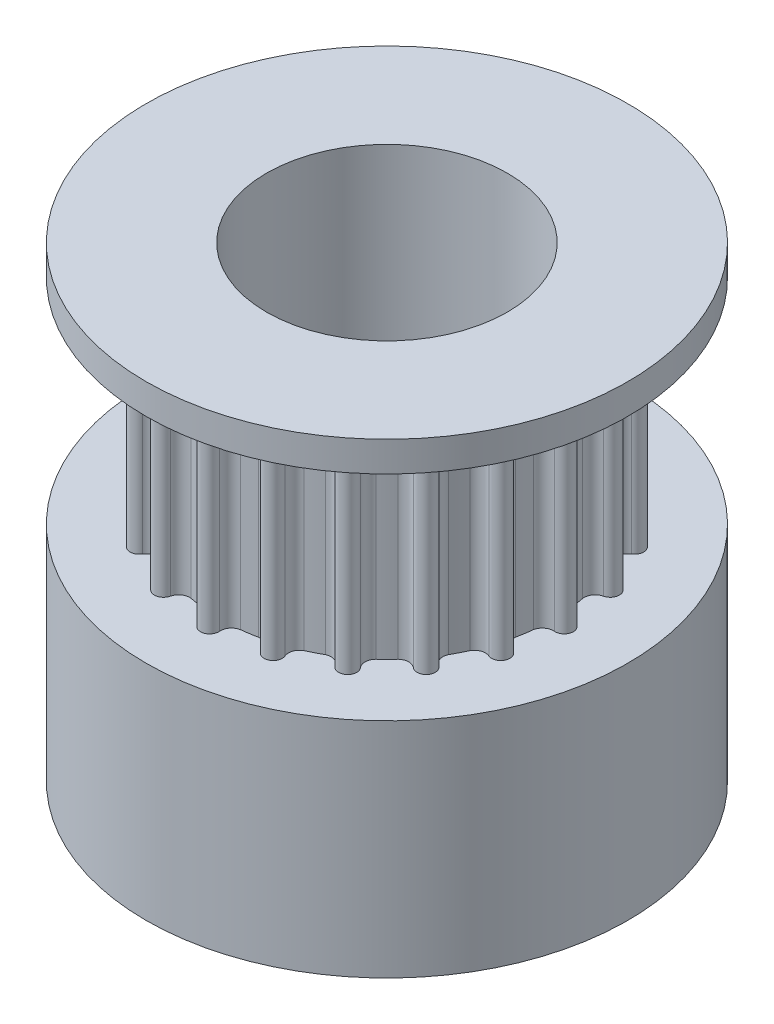
from build123d import *

# Parameters (mm, degrees)
SKETCH2_R               = 8
SKETCH2_R_2             = 4
BOSS_EXTRUDE1_DEPTH     = 15.5
CUT_EXTRUDE1_START      = -8.1
SKETCH3_R               = 8
CUT_EXTRUDE1_DEPTH      = 7.1
CUT_EXTRUDE2_REACH      = 21.19
CUT_EXTRUDE2_END_RADIUS = 8
SKETCH4_R               = 2
CUT_EXTRUDE3_REACH      = 21.19
CUT_EXTRUDE3_END_RADIUS = 8
SKETCH5_R               = 2


with BuildPart() as part:
    # Sketch2 → Boss-Extrude1 (new body)
    with BuildSketch(Plane(origin=(0, 0, 0), x_dir=(1, 0, 0), z_dir=(0, 1, 0))):
        with Locations(Location((0, 0, 0), (0, 0, 270))):
            Circle(SKETCH2_R)
        with Locations(Location((0, 0, 0), (0, 0, 270))):
            Circle(SKETCH2_R_2, mode=Mode.SUBTRACT)
    extrude(amount=BOSS_EXTRUDE1_DEPTH)

    # Sketch3 → Cut-Extrude1 (cut)
    with BuildSketch(Plane(origin=(0, 15.5, 0), x_dir=(1, 0, 0), z_dir=(0, 1, 0)).offset(CUT_EXTRUDE1_START)):
        with Locations(Location((0, 0, 0), (0, 0, 270))):
            Circle(SKETCH3_R)
        with BuildLine():
            ThreePointArc((-0.3, 5.863923227), (0, 6.190300649), (0.3, 5.863923227))
            ThreePointArc((0.3, 5.863923227), (0.374015387, 5.608093492), (0.6, 5.467174773))
            ThreePointArc((0.6, 5.467174773), (0.860389558, 5.432285873), (1.118816006, 5.38500239))
            ThreePointArc((1.118816006, 5.38500239), (1.377286424, 5.44919097), (1.526734976, 5.669627494))
            ThreePointArc((1.526734976, 5.669627494), (1.912908101, 5.88732577), (2.097368886, 5.484217297))
            ThreePointArc((2.097368886, 5.484217297), (2.088705966, 5.218036749), (2.260083826, 5.014181997))
            ThreePointArc((2.260083826, 5.014181997), (2.496947749, 4.900535883), (2.728114507, 4.775708454))
            ThreePointArc((2.728114507, 4.775708454), (2.993769844, 4.75688367), (3.204022495, 4.92034912))
            ThreePointArc((3.204022495, 4.92034912), (3.638567429, 5.008058426), (3.689432692, 4.567677968))
            ThreePointArc((3.689432692, 4.567677968), (3.598939452, 4.317202212), (3.6989349, 4.070366151))
            ThreePointArc((3.6989349, 4.070366151), (3.889087297, 3.889087297), (4.070366151, 3.6989349))
            ThreePointArc((4.070366151, 3.6989349), (4.317202212, 3.598939452), (4.567677968, 3.689432692))
            ThreePointArc((4.567677968, 3.689432692), (5.008058426, 3.638567429), (4.92034912, 3.204022495))
            ThreePointArc((4.92034912, 3.204022495), (4.75688367, 2.993769844), (4.775708454, 2.728114507))
            ThreePointArc((4.775708454, 2.728114507), (4.900535883, 2.496947749), (5.014181997, 2.260083826))
            ThreePointArc((5.014181997, 2.260083826), (5.218036749, 2.088705966), (5.484217297, 2.097368886))
            ThreePointArc((5.484217297, 2.097368886), (5.88732577, 1.912908101), (5.669627494, 1.526734976))
            ThreePointArc((5.669627494, 1.526734976), (5.44919097, 1.377286424), (5.38500239, 1.118816006))
            ThreePointArc((5.38500239, 1.118816006), (5.432285873, 0.860389558), (5.467174773, 0.6))
            ThreePointArc((5.467174773, 0.6), (5.608093492, 0.374015387), (5.863923227, 0.3))
            ThreePointArc((5.863923227, 0.3), (6.190300649, 0), (5.863923227, -0.3))
            ThreePointArc((5.863923227, -0.3), (5.608093492, -0.374015387), (5.467174773, -0.6))
            ThreePointArc((5.467174773, -0.6), (5.432285873, -0.860389558), (5.38500239, -1.118816006))
            ThreePointArc((5.38500239, -1.118816006), (5.44919097, -1.377286424), (5.669627494, -1.526734976))
            ThreePointArc((5.669627494, -1.526734976), (5.88732577, -1.912908101), (5.484217297, -2.097368886))
            ThreePointArc((5.484217297, -2.097368886), (5.218036749, -2.088705966), (5.014181997, -2.260083826))
            ThreePointArc((5.014181997, -2.260083826), (4.900535883, -2.496947749), (4.775708454, -2.728114507))
            ThreePointArc((4.775708454, -2.728114507), (4.75688367, -2.993769844), (4.92034912, -3.204022495))
            ThreePointArc((4.92034912, -3.204022495), (5.008058426, -3.638567429), (4.567677968, -3.689432692))
            ThreePointArc((4.567677968, -3.689432692), (4.317202212, -3.598939452), (4.070366151, -3.6989349))
            ThreePointArc((4.070366151, -3.6989349), (3.889087297, -3.889087297), (3.6989349, -4.070366151))
            ThreePointArc((3.6989349, -4.070366151), (3.598939452, -4.317202212), (3.689432692, -4.567677968))
            ThreePointArc((3.689432692, -4.567677968), (3.638567429, -5.008058426), (3.204022495, -4.92034912))
            ThreePointArc((3.204022495, -4.92034912), (2.993769844, -4.75688367), (2.728114507, -4.775708454))
            ThreePointArc((2.728114507, -4.775708454), (2.496947749, -4.900535883), (2.260083826, -5.014181997))
            ThreePointArc((2.260083826, -5.014181997), (2.088705966, -5.218036749), (2.097368886, -5.484217297))
            ThreePointArc((2.097368886, -5.484217297), (1.912908101, -5.88732577), (1.526734976, -5.669627494))
            ThreePointArc((1.526734976, -5.669627494), (1.377286424, -5.44919097), (1.118816006, -5.38500239))
            ThreePointArc((1.118816006, -5.38500239), (0.860389558, -5.432285873), (0.6, -5.467174773))
            ThreePointArc((0.6, -5.467174773), (0.374015387, -5.608093492), (0.3, -5.863923227))
            ThreePointArc((0.3, -5.863923227), (0, -6.190300649), (-0.3, -5.863923227))
            ThreePointArc((-0.3, -5.863923227), (-0.374015387, -5.608093492), (-0.6, -5.467174773))
            ThreePointArc((-0.6, -5.467174773), (-0.860389558, -5.432285873), (-1.118816006, -5.38500239))
            ThreePointArc((-1.118816006, -5.38500239), (-1.377286424, -5.44919097), (-1.526734976, -5.669627494))
            ThreePointArc((-1.526734976, -5.669627494), (-1.912908101, -5.88732577), (-2.097368886, -5.484217297))
            ThreePointArc((-2.097368886, -5.484217297), (-2.088705966, -5.218036749), (-2.260083826, -5.014181997))
            ThreePointArc((-2.260083826, -5.014181997), (-2.496947749, -4.900535883), (-2.728114507, -4.775708454))
            ThreePointArc((-2.728114507, -4.775708454), (-2.993769844, -4.75688367), (-3.204022495, -4.92034912))
            ThreePointArc((-3.204022495, -4.92034912), (-3.638567429, -5.008058426), (-3.689432692, -4.567677968))
            ThreePointArc((-3.689432692, -4.567677968), (-3.598939452, -4.317202212), (-3.6989349, -4.070366151))
            ThreePointArc((-3.6989349, -4.070366151), (-3.889087297, -3.889087297), (-4.070366151, -3.6989349))
            ThreePointArc((-4.070366151, -3.6989349), (-4.317202212, -3.598939452), (-4.567677968, -3.689432692))
            ThreePointArc((-4.567677968, -3.689432692), (-5.008058426, -3.638567429), (-4.92034912, -3.204022495))
            ThreePointArc((-4.92034912, -3.204022495), (-4.75688367, -2.993769844), (-4.775708454, -2.728114507))
            ThreePointArc((-4.775708454, -2.728114507), (-4.900535883, -2.496947749), (-5.014181997, -2.260083826))
            ThreePointArc((-5.014181997, -2.260083826), (-5.218036749, -2.088705966), (-5.484217297, -2.097368886))
            ThreePointArc((-5.484217297, -2.097368886), (-5.88732577, -1.912908101), (-5.669627494, -1.526734976))
            ThreePointArc((-5.669627494, -1.526734976), (-5.44919097, -1.377286424), (-5.38500239, -1.118816006))
            ThreePointArc((-5.38500239, -1.118816006), (-5.432285873, -0.860389558), (-5.467174773, -0.6))
            ThreePointArc((-5.467174773, -0.6), (-5.608093492, -0.374015387), (-5.863923227, -0.3))
            ThreePointArc((-5.863923227, -0.3), (-6.190300649, 0), (-5.863923227, 0.3))
            ThreePointArc((-5.863923227, 0.3), (-5.608093492, 0.374015387), (-5.467174773, 0.6))
            ThreePointArc((-5.467174773, 0.6), (-5.432285873, 0.860389558), (-5.38500239, 1.118816006))
            ThreePointArc((-5.38500239, 1.118816006), (-5.44919097, 1.377286424), (-5.669627494, 1.526734976))
            ThreePointArc((-5.669627494, 1.526734976), (-5.88732577, 1.912908101), (-5.484217297, 2.097368886))
            ThreePointArc((-5.484217297, 2.097368886), (-5.218036749, 2.088705966), (-5.014181997, 2.260083826))
            ThreePointArc((-5.014181997, 2.260083826), (-4.900535883, 2.496947749), (-4.775708454, 2.728114507))
            ThreePointArc((-4.775708454, 2.728114507), (-4.75688367, 2.993769844), (-4.92034912, 3.204022495))
            ThreePointArc((-4.92034912, 3.204022495), (-5.008058426, 3.638567429), (-4.567677968, 3.689432692))
            ThreePointArc((-4.567677968, 3.689432692), (-4.317202212, 3.598939452), (-4.070366151, 3.6989349))
            ThreePointArc((-4.070366151, 3.6989349), (-3.889087297, 3.889087297), (-3.6989349, 4.070366151))
            ThreePointArc((-3.6989349, 4.070366151), (-3.598939452, 4.317202212), (-3.689432692, 4.567677968))
            ThreePointArc((-3.689432692, 4.567677968), (-3.638567429, 5.008058426), (-3.204022495, 4.92034912))
            ThreePointArc((-3.204022495, 4.92034912), (-2.993769844, 4.75688367), (-2.728114507, 4.775708454))
            ThreePointArc((-2.728114507, 4.775708454), (-2.496947749, 4.900535883), (-2.260083826, 5.014181997))
            ThreePointArc((-2.260083826, 5.014181997), (-2.088705966, 5.218036749), (-2.097368886, 5.484217297))
            ThreePointArc((-2.097368886, 5.484217297), (-1.912908101, 5.88732577), (-1.526734976, 5.669627494))
            ThreePointArc((-1.526734976, 5.669627494), (-1.377286424, 5.44919097), (-1.118816006, 5.38500239))
            ThreePointArc((-1.118816006, 5.38500239), (-0.860389558, 5.432285873), (-0.6, 5.467174773))
            ThreePointArc((-0.6, 5.467174773), (-0.374015387, 5.608093492), (-0.3, 5.863923227))
        make_face(mode=Mode.SUBTRACT)
    extrude(amount=CUT_EXTRUDE1_DEPTH, mode=Mode.SUBTRACT)

    # Cut-Extrude2: up to this cylinder (the profile starts inside it)
    cut_extrude2_end = Plane(origin=(0, 3.75, 0), z_dir=(0, -1, 0)) * Cylinder(CUT_EXTRUDE2_END_RADIUS, 59.38, mode=Mode.PRIVATE)
    # Sketch4 → Cut-Extrude2 (cut, up to the surface)
    with BuildSketch(Plane.XY, mode=Mode.PRIVATE) as cut_extrude2_sk1:
        with Locations((0, 3.75)):
            Circle(SKETCH4_R)
    cut_extrude2_tool1 = extrude(cut_extrude2_sk1.sketch, amount=-CUT_EXTRUDE2_REACH, mode=Mode.PRIVATE) & cut_extrude2_end
    add(cut_extrude2_tool1.solids().sort_by_distance((0, 3.75, 0))[0], mode=Mode.SUBTRACT)

    # Cut-Extrude3: up to this cylinder (the profile starts inside it)
    cut_extrude3_end = Plane(origin=(0, 3.75, 0), z_dir=(0, -1, 0)) * Cylinder(CUT_EXTRUDE3_END_RADIUS, 59.38, mode=Mode.PRIVATE)
    # Sketch5 → Cut-Extrude3 (cut, up to the surface)
    with BuildSketch(Plane(origin=(0, 0, 0), x_dir=(0, 0, -1), z_dir=(1, 0, 0)), mode=Mode.PRIVATE) as cut_extrude3_sk1:
        with Locations((0, 3.75)):
            Circle(SKETCH5_R)
    cut_extrude3_tool1 = extrude(cut_extrude3_sk1.sketch, amount=-CUT_EXTRUDE3_REACH, mode=Mode.PRIVATE) & cut_extrude3_end
    add(cut_extrude3_tool1.solids().sort_by_distance((0, 3.75, 0))[0], mode=Mode.SUBTRACT)


solid = part.part
